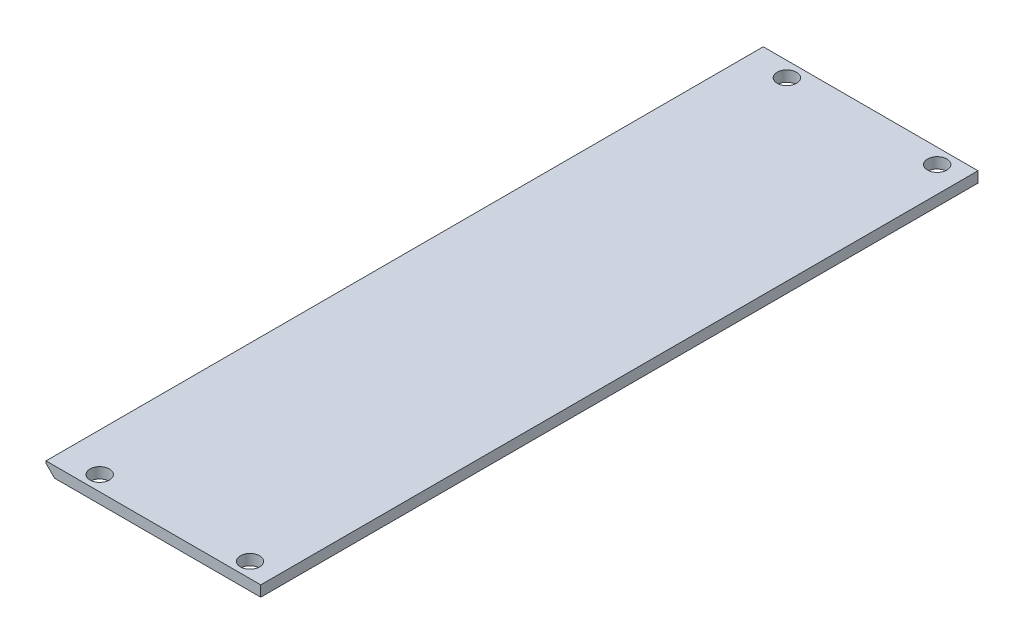
from build123d import *

# Parameters (mm, degrees)
SKIZZE10_W                      = 100
SKIZZE10_H                      = 334
AUFSATZ_LINEAR_AUSTRAGEN1_DEPTH = 5
FASE1_SIZE                      = 4
DURCHGANGSLOCH_F_R_M81_D        = 9


with BuildPart() as part:
    # Skizze10 → Aufsatz-Linear austragen1 (new body)
    with BuildSketch(Plane(origin=(0, 0, 0), x_dir=(1, 0, 0), z_dir=(0, 1, 0))):
        with Locations((50, 0)):
            Rectangle(SKIZZE10_W, SKIZZE10_H)
    extrude(amount=AUFSATZ_LINEAR_AUSTRAGEN1_DEPTH)

    # Fase1
    fase1_edges = [part.edges().sort_by_distance(p)[0] for p in [
        (0, 0, 0),
    ]]
    chamfer(fase1_edges, length=FASE1_SIZE)

    # Durchgangsloch für M81 (through all)
    with Locations(Plane(origin=(0, 5, 0), x_dir=(1, 0, 0), z_dir=(0, 1, 0))):
        with Locations((18, -160), (18, 160), (88, -160), (88, 160)):
            Hole(DURCHGANGSLOCH_F_R_M81_D / 2)


solid = part.part
